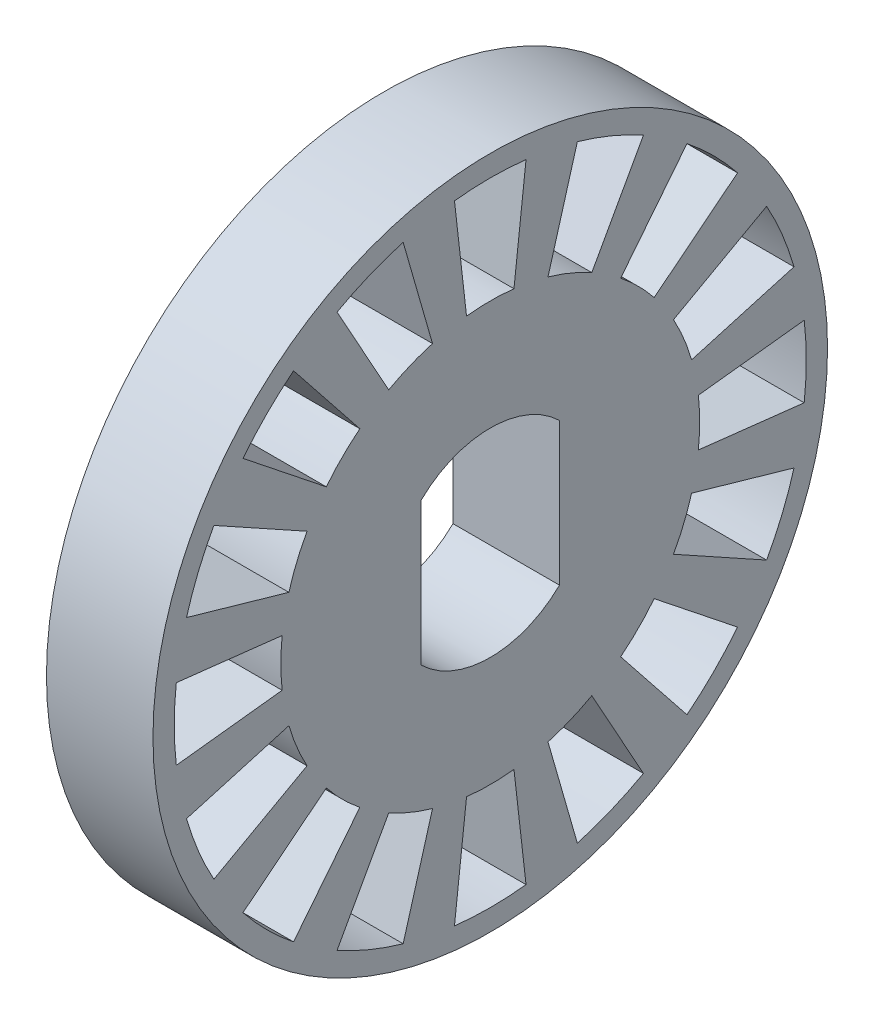
from build123d import *

# Parameters (mm, degrees)
SKETCH1_R           = 9.5
SKETCH1_R_2         = 2.8
BOSS_EXTRUDE1_DEPTH = 3
CUT_EXTRUDE2_DEPTH  = 3
CIRPATTERN1_COUNT   = 16


with BuildPart() as part:
    # Sketch1 → Boss-Extrude1 (new body)
    # profile 1 of 3: a face of its own
    with BuildSketch(Plane(origin=(0, 0, 0), x_dir=(0, 0, -1), z_dir=(1, 0, 0))):
        Circle(SKETCH1_R)
        Circle(SKETCH1_R_2, mode=Mode.SUBTRACT)
    # profile 2 of 3: a face of its own
    with BuildSketch(Plane(origin=(0, 0, 0), x_dir=(0, 0, -1), z_dir=(1, 0, 0))):
        with BuildLine():
            Line((1.95, 2.00935313), (1.95, -2.00935313))
            ThreePointArc((1.95, -2.00935313), (2.578759392, -1.090871211), (2.8, 0))
            ThreePointArc((2.8, 0), (2.578759392, 1.090871211), (1.95, 2.00935313))
        make_face()
    # profile 3 of 3: a face of its own
    with BuildSketch(Plane(origin=(0, 0, 0), x_dir=(0, 0, -1), z_dir=(1, 0, 0))):
        with BuildLine():
            ThreePointArc((-1.95, 2.00935313), (-2.8, 0), (-1.95, -2.00935313))
            Line((-1.95, -2.00935313), (-1.95, 2.00935313))
        make_face()
    extrude(amount=BOSS_EXTRUDE1_DEPTH)

    # Sketch3 → Cut-Extrude2 (cut)
    with BuildSketch(Plane(origin=(3, 0, 0), x_dir=(0, 0, -1), z_dir=(1, 0, 0))):
        with BuildLine():
            Line((-1.007508603, 8.842789516), (-0.667898961, 5.862073948))
            ThreePointArc((-0.667898961, 5.862073948), (0, 5.9), (0.667898961, 5.862073948))
            Line((0.667898961, 5.862073948), (1.007508603, 8.842789516))
            ThreePointArc((1.007508603, 8.842789516), (0, 8.9), (-1.007508603, 8.842789516))
        make_face()
    cut_extrude2 = extrude(amount=-CUT_EXTRUDE2_DEPTH, mode=Mode.SUBTRACT)

    # CirPattern1: Cut-Extrude2 ×16 about axis
    cirpattern1_axis = Axis((0, 0, 0), (1, 0, 0))
    for i in range(1, CIRPATTERN1_COUNT):
        add(cut_extrude2.rotate(cirpattern1_axis, i * 360 / CIRPATTERN1_COUNT), mode=Mode.SUBTRACT)


solid = part.part
